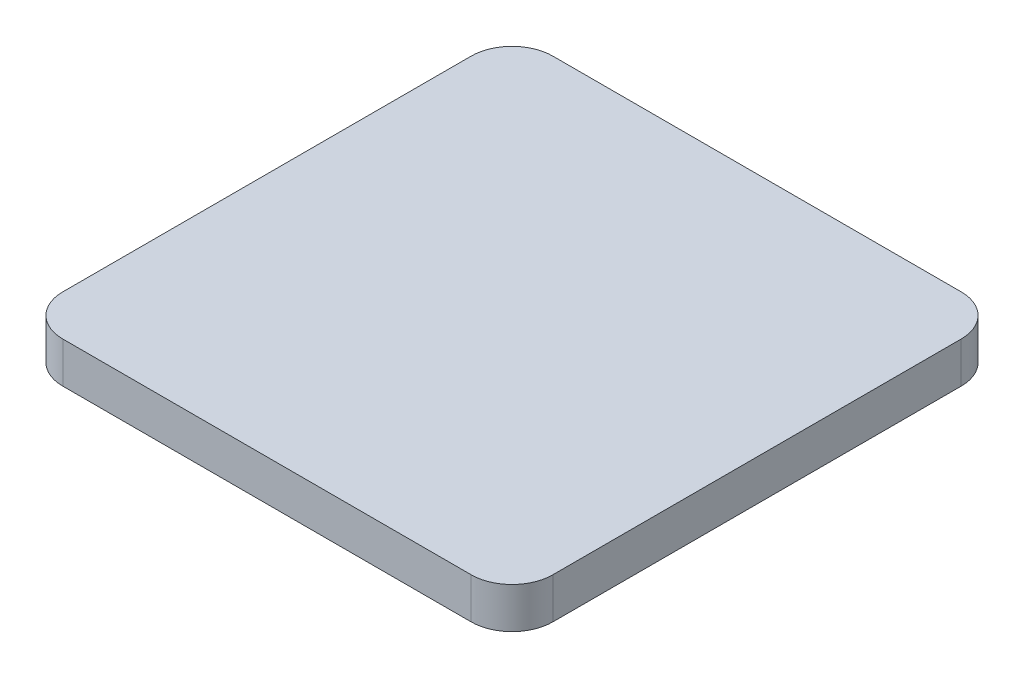
from build123d import *

# Parameters (mm, degrees)
SKETCH2_W           = 60
SKETCH2_H           = 60
BOSS_EXTRUDE1_DEPTH = 5
FILLET1_R           = 5


with BuildPart() as part:
    # Sketch2 → Boss-Extrude1 (new body)
    with BuildSketch(Plane(origin=(0, 0, 0), x_dir=(1, 0, 0), z_dir=(0, 1, 0))):
        Rectangle(SKETCH2_W, SKETCH2_H)
    extrude(amount=BOSS_EXTRUDE1_DEPTH)

    # Fillet1
    fillet1_edges = [part.edges().sort_by_distance(p)[0] for p in [
        (30, 2.5, 30),
        (-30, 2.5, 30),
        (-30, 2.5, -30),
        (30, 2.5, -30),
    ]]
    fillet(fillet1_edges, radius=FILLET1_R)


solid = part.part
